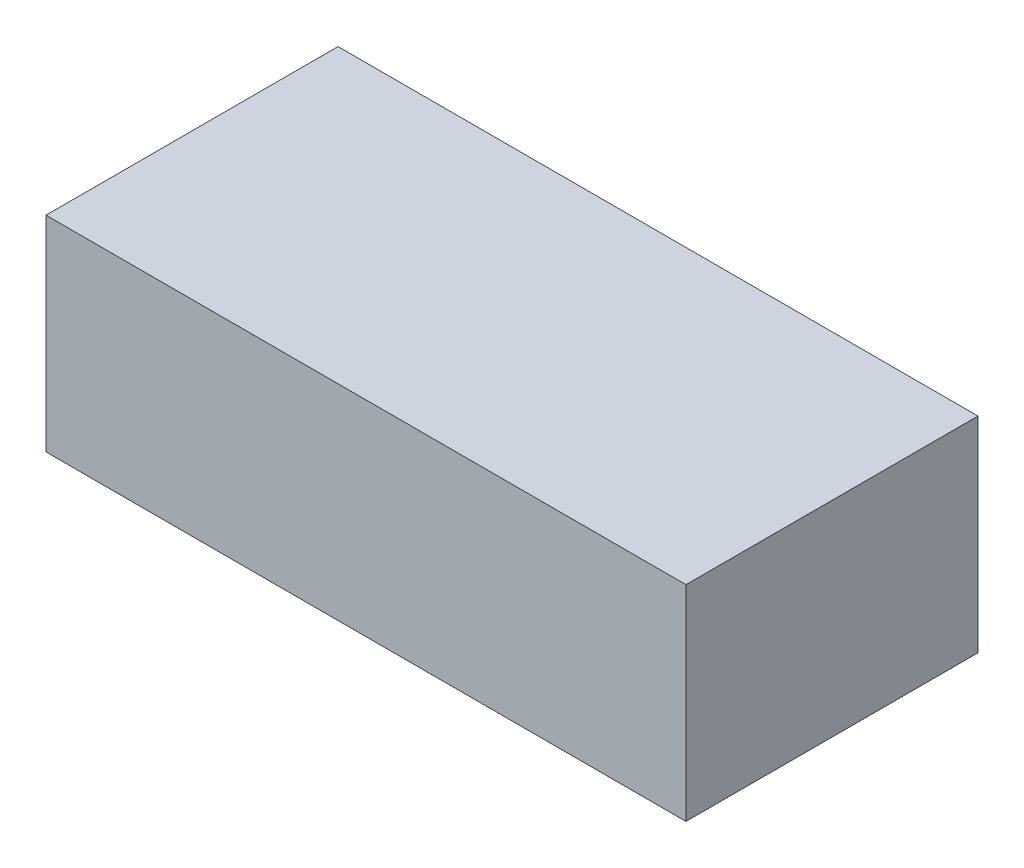
from build123d import *

# Parameters (mm, degrees)
ESBO_O1_W                = 103
ESBO_O1_H                = 33
RESSALTO_EXTRUS_O1_DEPTH = 23.5


with BuildPart() as part:
    # Esboço1 → Ressalto-extrusão1 (new, symmetric)
    with BuildSketch(Plane.XY):
        Rectangle(ESBO_O1_W, ESBO_O1_H)
    extrude(amount=RESSALTO_EXTRUS_O1_DEPTH, both=True)


solid = part.part
